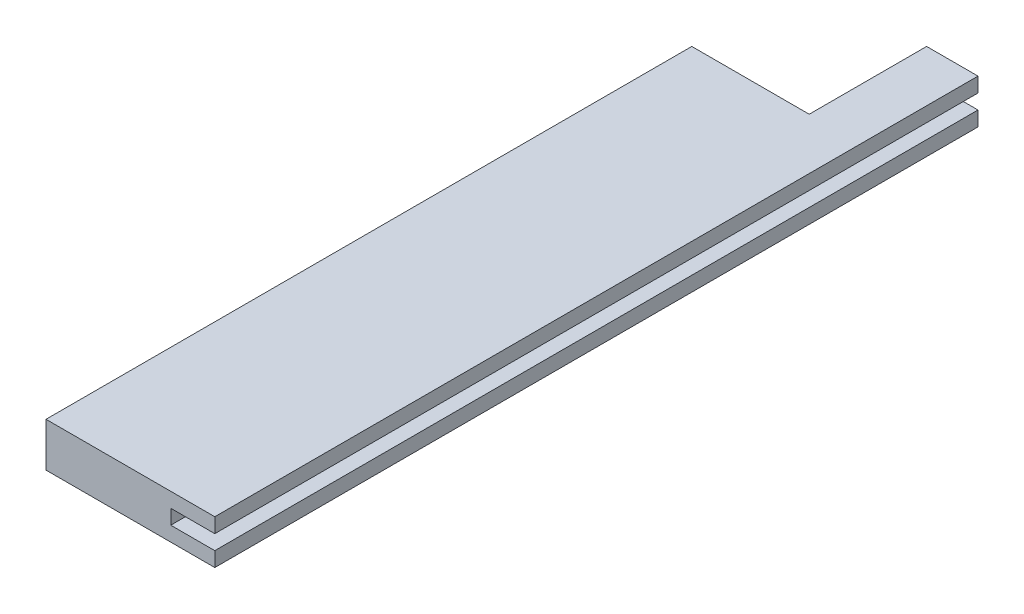
from build123d import *

# Parameters (mm, degrees)
BOSS_EXTRUDE1_DEPTH = 9.525
CUT_EXTRUDE1_REACH  = 337.179
SKETCH2_W           = 19.05
SKETCH2_H           = 6.35


with BuildPart() as part:
    # Sketch1 → Boss-Extrude1 (new, symmetric)
    with BuildSketch(Plane(origin=(0, 0, 0), x_dir=(1, 0, 0), z_dir=(0, 1, 0))):
        Polygon((-56.762661738, -101.318299445), (16.262338262, -101.318299445), (16.262338262, 228.881700555), (-5.962661738, 228.881700555), (-5.962661738, 178.081700555), (-56.762661738, 178.081700555), align=None)
    extrude(amount=BOSS_EXTRUDE1_DEPTH, both=True)

    # Sketch2 → Cut-Extrude1 (cut, up to next)
    with BuildSketch(Plane.XY.offset(101.318299445), mode=Mode.PRIVATE) as cut_extrude1_sk1:
        with Locations((6.737338262, 0)):
            Rectangle(SKETCH2_W, SKETCH2_H)
    cut_extrude1_tool1 = extrude(cut_extrude1_sk1.sketch, amount=-CUT_EXTRUDE1_REACH, mode=Mode.PRIVATE) & part.part
    add(cut_extrude1_tool1.solids().sort_by_distance((6.737338, 0, 101.318299))[0], mode=Mode.SUBTRACT)


solid = part.part
